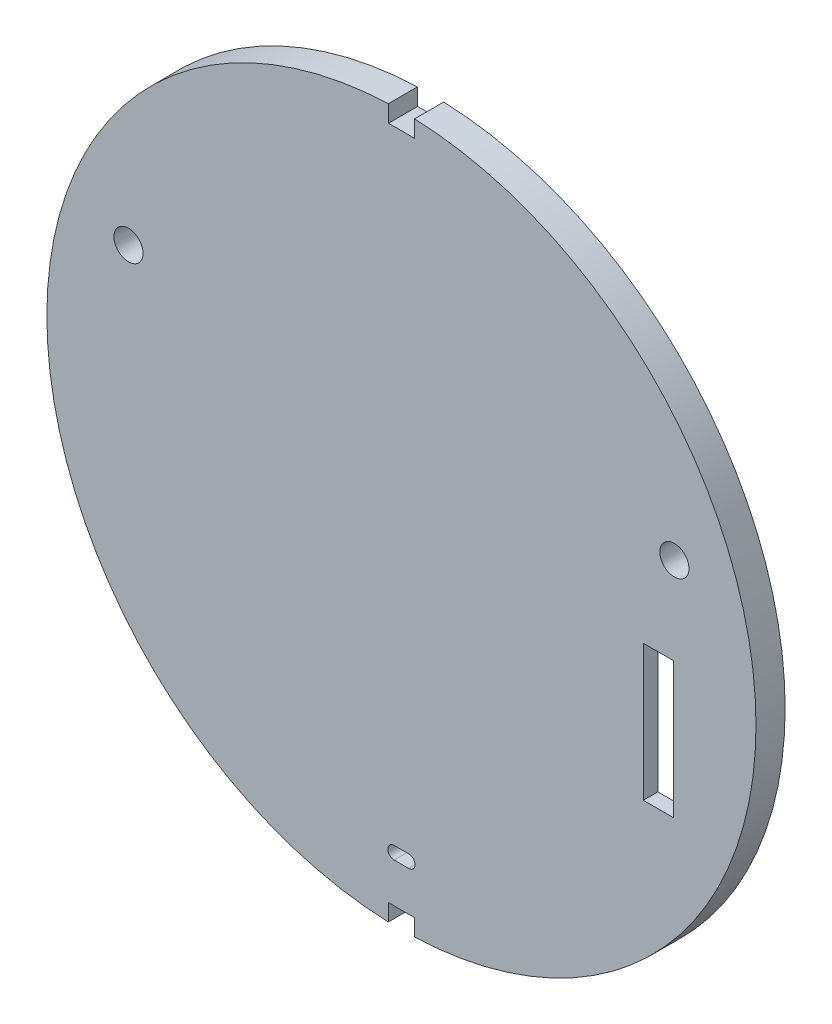
from build123d import *

# Parameters (mm, degrees)
SKETCH1_R           = 1.5
BOSS_EXTRUDE3_DEPTH = 3
BOSS_EXTRUDE4_DEPTH = 1.5


with BuildPart() as part:
    # Sketch1 → Boss-Extrude3 (new body)
    with BuildSketch(Plane.XY):
        with BuildLine():
            Line((-1.35, 34.723767077), (-1.35, 36.475025703))
            ThreePointArc((-1.35, 36.475025703), (-36.5, 0), (-1.35, -36.475025703))
            Line((-1.35, -36.475025703), (-1.35, -34.723767077))
            ThreePointArc((-1.35, -34.723767077), (0, -34.75), (1.35, -34.723767077))
            Line((1.35, -34.723767077), (1.35, -36.475025703))
            ThreePointArc((1.35, -36.475025703), (36.5, 0), (1.35, 36.475025703))
            Line((1.35, 36.475025703), (1.35, 34.723767077))
            ThreePointArc((1.35, 34.723767077), (0, 34.75), (-1.35, 34.723767077))
        make_face()
        with BuildLine():
            ThreePointArc((-0.75, -30.65), (-1.4, -30), (-0.75, -29.35))
            Line((-0.75, -29.35), (0.75, -29.35))
            ThreePointArc((0.75, -29.35), (1.4, -30), (0.75, -30.65))
            Line((0.75, -30.65), (-0.75, -30.65))
        make_face(mode=Mode.SUBTRACT)
        Polygon((-28, -17), (-28, 4.5), (28, 4.5), (28, 1.5), (28, -12.5), (28, -17), (21.5, -23.5), (-21.5, -23.5), align=None, mode=Mode.SUBTRACT)
        with Locations((-28.1, 10.5)):
            Circle(SKETCH1_R, mode=Mode.SUBTRACT)
        with Locations((28.1, 10.5)):
            Circle(SKETCH1_R, mode=Mode.SUBTRACT)
    extrude(amount=-BOSS_EXTRUDE3_DEPTH)

    # Sketch1<9> → Boss-Extrude4 (add)
    with BuildSketch(Plane.XY):
        Polygon((28, 4.5), (-28, 4.5), (-28, -17), (-21.5, -23.5), (21.5, -23.5), (28, -17), (28, -12.5), (24.9, -12.5), (24.9, 1.5), (28, 1.5), align=None)
    extrude(amount=-BOSS_EXTRUDE4_DEPTH)


solid = part.part
